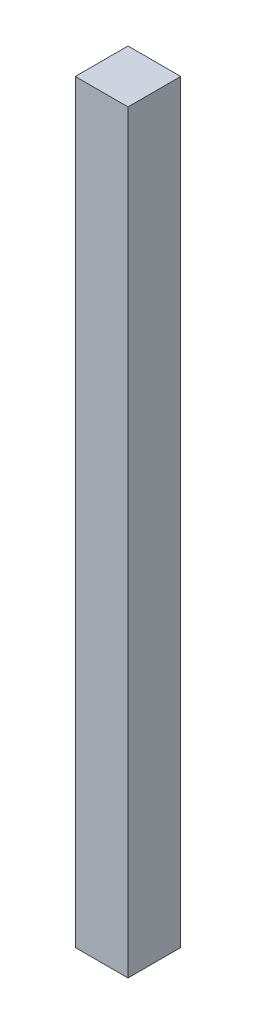
from build123d import *

# Parameters (mm, degrees)
SKETCH1_W           = 10.48808848
SKETCH1_H           = 10.48808848
BOSS_EXTRUDE1_DEPTH = 150


with BuildPart() as part:
    # Sketch1 → Boss-Extrude1 (new body)
    with BuildSketch(Plane(origin=(0, 0, 0), x_dir=(1, 0, 0), z_dir=(0, 1, 0))):
        Rectangle(SKETCH1_W, SKETCH1_H)
    extrude(amount=BOSS_EXTRUDE1_DEPTH)


solid = part.part
